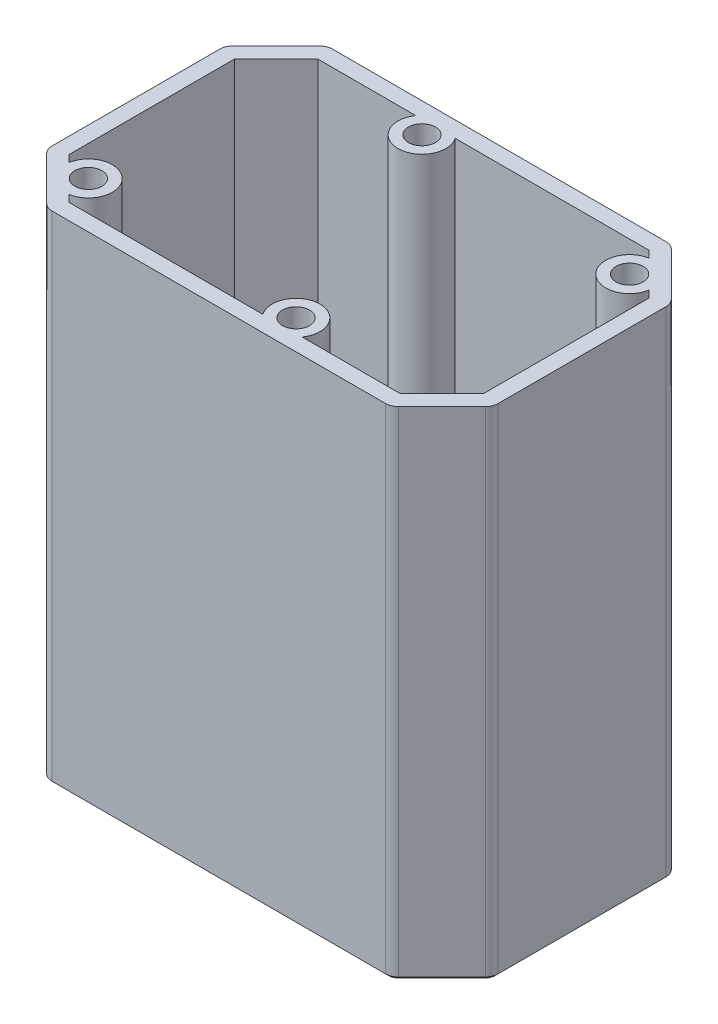
from build123d import *

# Parameters (mm, degrees)
BOSS_EXTRUDE1_DEPTH = 3
SKETCH1_4_R         = 2.125
BOSS_EXTRUDE2_DEPTH = 78
CHAMFER1_SIZE       = 0.5


with BuildPart() as part:
    # Sketch1 → Boss-Extrude1 (new body)
    with BuildSketch(Plane(origin=(0, 0, 0), x_dir=(1, 0, 0), z_dir=(0, 1, 0))):
        with BuildLine():
            Line((26.171572875, 22), (-26.171572875, 22))
            ThreePointArc((-26.171572875, 22), (-26.93693974, 21.847759065), (-27.585786438, 21.414213562))
            Line((-27.585786438, 21.414213562), (-34.414213562, 14.585786438))
            ThreePointArc((-34.414213562, 14.585786438), (-34.847759065, 13.93693974), (-35, 13.171572875))
            Line((-35, 13.171572875), (-35, -13.171572875))
            ThreePointArc((-35, -13.171572875), (-34.847759065, -13.93693974), (-34.414213562, -14.585786438))
            Line((-34.414213562, -14.585786438), (-27.585786438, -21.414213562))
            ThreePointArc((-27.585786438, -21.414213562), (-26.93693974, -21.847759065), (-26.171572875, -22))
            Line((-26.171572875, -22), (26.171572875, -22))
            ThreePointArc((26.171572875, -22), (26.93693974, -21.847759065), (27.585786438, -21.414213562))
            Line((27.585786438, -21.414213562), (34.414213562, -14.585786438))
            ThreePointArc((34.414213562, -14.585786438), (34.847759065, -13.93693974), (35, -13.171572875))
            Line((35, -13.171572875), (35, 13.171572875))
            ThreePointArc((35, 13.171572875), (34.847759065, 13.93693974), (34.414213562, 14.585786438))
            Line((34.414213562, 14.585786438), (27.585786438, 21.414213562))
            ThreePointArc((27.585786438, 21.414213562), (26.93693974, 21.847759065), (26.171572875, 22))
        make_face()
    extrude(amount=BOSS_EXTRUDE1_DEPTH)

    # Sketch1<4> → Boss-Extrude2 (add)
    with BuildSketch(Plane(origin=(0, 0, 0), x_dir=(1, 0, 0), z_dir=(0, 1, 0))):
        with BuildLine():
            ThreePointArc((27.585786438, 21.414213562), (26.93693974, 21.847759065), (26.171572875, 22))
            Line((26.171572875, 22), (-26.171572875, 22))
            ThreePointArc((-26.171572875, 22), (-26.93693974, 21.847759065), (-27.585786438, 21.414213562))
            Line((-27.585786438, 21.414213562), (-34.414213562, 14.585786438))
            ThreePointArc((-34.414213562, 14.585786438), (-34.847759065, 13.93693974), (-35, 13.171572875))
            Line((-35, 13.171572875), (-35, -13.171572875))
            ThreePointArc((-35, -13.171572875), (-34.847759065, -13.93693974), (-34.414213562, -14.585786438))
            Line((-34.414213562, -14.585786438), (-27.585786438, -21.414213562))
            ThreePointArc((-27.585786438, -21.414213562), (-26.93693974, -21.847759065), (-26.171572875, -22))
            Line((-26.171572875, -22), (26.171572875, -22))
            ThreePointArc((26.171572875, -22), (26.93693974, -21.847759065), (27.585786438, -21.414213562))
            Line((27.585786438, -21.414213562), (34.414213562, -14.585786438))
            ThreePointArc((34.414213562, -14.585786438), (34.847759065, -13.93693974), (35, -13.171572875))
            Line((35, -13.171572875), (35, 13.171572875))
            ThreePointArc((35, 13.171572875), (34.847759065, 13.93693974), (34.414213562, 14.585786438))
            Line((34.414213562, 14.585786438), (27.585786438, 21.414213562))
        make_face()
        with BuildLine():
            Line((-32.5, -12.964466094), (-32.5, 12.964466094))
            Line((-32.5, 12.964466094), (-25.964466094, 19.5))
            Line((-25.964466094, 19.5), (-10.589801774, 19.5))
            ThreePointArc((-10.589801774, 19.5), (-7.5, 13.625), (-4.410198226, 19.5))
            Line((-4.410198226, 19.5), (25.964466094, 19.5))
            Line((25.964466094, 19.5), (27.04741326, 18.417052834))
            ThreePointArc((27.04741326, 18.417052834), (25.077980708, 12.077980708), (31.417052834, 14.04741326))
            Line((31.417052834, 14.04741326), (32.5, 12.964466094))
            Line((32.5, 12.964466094), (32.5, -12.964466094))
            Line((32.5, -12.964466094), (25.964466094, -19.5))
            Line((25.964466094, -19.5), (10.589801774, -19.5))
            ThreePointArc((10.589801774, -19.5), (7.5, -13.625), (4.410198226, -19.5))
            Line((4.410198226, -19.5), (-25.964466094, -19.5))
            Line((-25.964466094, -19.5), (-27.04741326, -18.417052834))
            ThreePointArc((-27.04741326, -18.417052834), (-25.077980708, -12.077980708), (-31.417052834, -14.04741326))
            Line((-31.417052834, -14.04741326), (-32.5, -12.964466094))
        make_face(mode=Mode.SUBTRACT)
        with Locations(Location((-27.729631137, -14.729631137, 0), (0, 0, 270))):
            Circle(SKETCH1_4_R, mode=Mode.SUBTRACT)
        with Locations(Location((-7.5, 17.375, 0), (0, 0, 270))):
            Circle(SKETCH1_4_R, mode=Mode.SUBTRACT)
        with Locations(Location((7.5, -17.375, 0), (0, 0, 270))):
            Circle(SKETCH1_4_R, mode=Mode.SUBTRACT)
        with Locations(Location((27.729631137, 14.729631137, 0), (0, 0, 270))):
            Circle(SKETCH1_4_R, mode=Mode.SUBTRACT)
    extrude(amount=BOSS_EXTRUDE2_DEPTH)

    # Chamfer1
    chamfer1_edges = [part.edges().sort_by_distance(p)[0] for p in [
        (-31, 0, 18),
        (-34.847759065, 0, 13.93693974),
        (-35, 0, 0),
        (-34.847759065, 0, -13.93693974),
        (-31, 0, -18),
        (-26.93693974, 0, -21.847759065),
        (0, 0, -22),
        (26.93693974, 0, -21.847759065),
        (31, 0, -18),
        (34.847759065, 0, -13.93693974),
        (35, 0, 0),
        (34.847759065, 0, 13.93693974),
        (31, 0, 18),
        (26.93693974, 0, 21.847759065),
        (0, 0, 22),
        (-26.93693974, 0, 21.847759065),
    ]]
    chamfer(chamfer1_edges, length=CHAMFER1_SIZE)


solid = part.part
